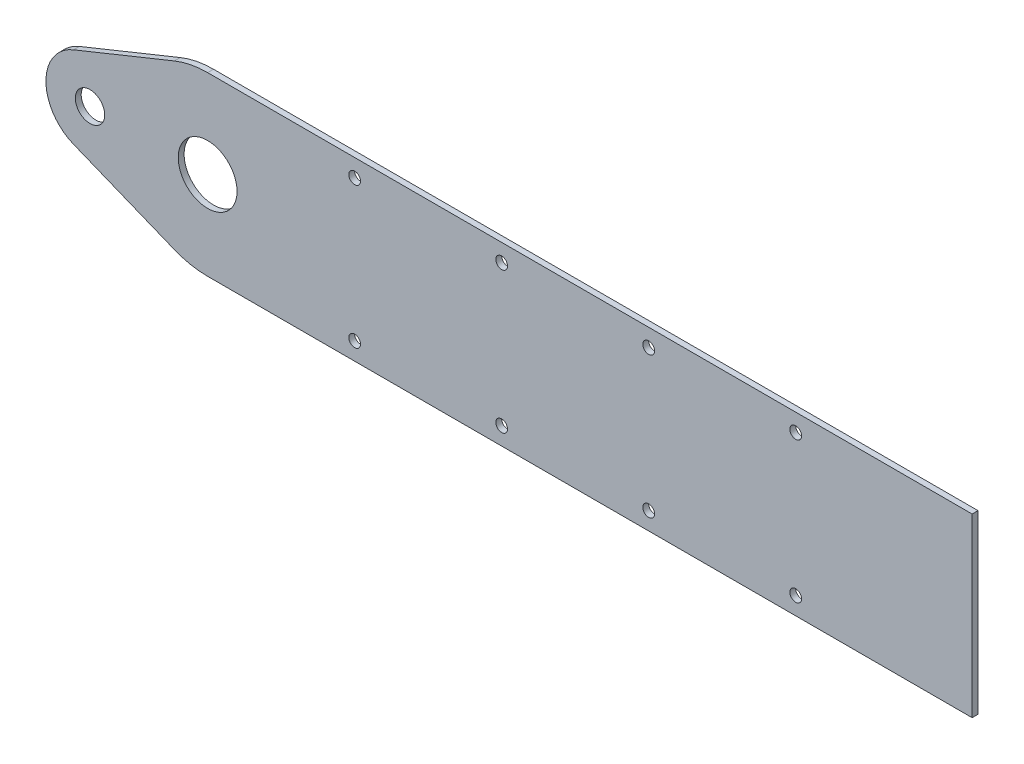
from build123d import *

# Parameters (mm, degrees)
SKETCH_1_R      = 2.5
SKETCH_1_R_2    = 5
SKETCH_1_R_3    = 1
EXTRUDE_1_DEPTH = 1


with BuildPart() as part:
    # Эскиз1 → Бобышка-Вытянуть1 (new body)
    with BuildSketch(Plane.XY):
        with BuildLine():
            Line((-5.644333703, 13.897551295), (-22.8125, 6.952686082))
            ThreePointArc((-22.8125, 6.952686082), (-27.5, 0), (-22.8125, -6.952686082))
            Line((-22.8125, -6.952686082), (-5.625, -13.905372163))
            ThreePointArc((-5.625, -13.905372163), (-2.865258937, -14.723800162), (0, -15))
            Line((0, -15), (130, -15))
            Line((130, -15), (130, 15))
            Line((130, 15), (0, 15))
            ThreePointArc((0, 15), (-2.875496154, 14.721811827), (-5.644333703, 13.897551295))
        make_face()
        with Locations((-20, 0)):
            Circle(SKETCH_1_R, mode=Mode.SUBTRACT)
        with Locations((-3.8531e-05, 0)):
            Circle(SKETCH_1_R_2, mode=Mode.SUBTRACT)
        with Locations((25, 12)):
            Circle(SKETCH_1_R_3, mode=Mode.SUBTRACT)
        with Locations((50, 12)):
            Circle(SKETCH_1_R_3, mode=Mode.SUBTRACT)
        with Locations((75, 12)):
            Circle(SKETCH_1_R_3, mode=Mode.SUBTRACT)
        with Locations((100, 12)):
            Circle(SKETCH_1_R_3, mode=Mode.SUBTRACT)
        with Locations((25, -12)):
            Circle(SKETCH_1_R_3, mode=Mode.SUBTRACT)
        with Locations((50, -12)):
            Circle(SKETCH_1_R_3, mode=Mode.SUBTRACT)
        with Locations((75, -12)):
            Circle(SKETCH_1_R_3, mode=Mode.SUBTRACT)
        with Locations((100, -12)):
            Circle(SKETCH_1_R_3, mode=Mode.SUBTRACT)
    extrude(amount=EXTRUDE_1_DEPTH)


solid = part.part
